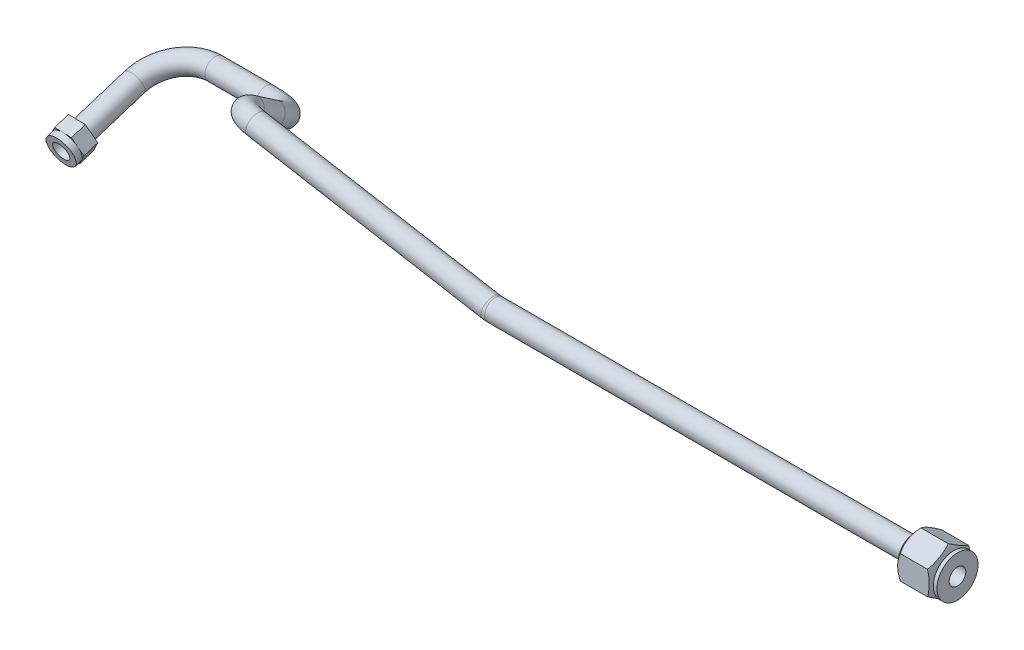
from build123d import *

# Parameters (mm, degrees)
SKETCH2_R             = 14.49115295
CUT_EXTRUDE1_DEPTH    = 51.306406252
SKETCH3_R             = 5
EXTRUDE1_DEPTH        = 10
SKETCH5_R             = 9.901602584
SKETCH5_R_2           = 7
CUT_EXTRUDE2_DEPTH    = 3
IZIM2_R               = 4
KES_EKSTR_ZYON1_DEPTH = 220
IZIM3_R               = 4
KES_EKSTR_ZYON2_DEPTH = 40


with BuildPart() as part:
    # Sketch1 → Revolve1 (revolve)
    with BuildSketch(Plane.XY, mode=Mode.PRIVATE) as revolve1_sk:
        with BuildLine():
            Line((180.080433705, 44.141017842), (173.530538009, 44.141017842))
            ThreePointArc((173.530538009, 44.141017842), (172.538729892, 41.151971535), (173.530538009, 38.162925228))
            Line((173.530538009, 38.162925228), (180.080433705, 38.162925228))
            Line((180.080433705, 38.162925228), (180.080433705, 44.141017842))
        make_face()
        with BuildLine():
            Line((186.630329401, 44.141017842), (180.080433705, 44.141017842))
            Line((180.080433705, 44.141017842), (180.080433705, 38.162925228))
            Line((180.080433705, 38.162925228), (186.630329401, 38.162925228))
            ThreePointArc((186.630329401, 38.162925228), (187.103282451, 38.934012994), (187.429565668, 39.777695512))
            ThreePointArc((187.429565668, 39.777695512), (187.540311425, 42.052840793), (186.630329401, 44.141017842))
        make_face()
        with BuildLine():
            Line((180.080433705, 38.162925228), (180.080433705, 32.650327481))
            Line((180.080433705, 32.650327481), (187.735613173, 32.650327481))
            ThreePointArc((187.735613173, 32.650327481), (187.427007794, 35.455556025), (186.630329401, 38.162925228))
            Line((186.630329401, 38.162925228), (180.080433705, 38.162925228))
        make_face()
        with BuildLine():
            ThreePointArc((173.530538009, 38.162925228), (172.733859616, 35.455556025), (172.425254237, 32.650327481))
            Line((172.425254237, 32.650327481), (180.080433705, 32.650327481))
            Line((180.080433705, 32.650327481), (180.080433705, 38.162925228))
            Line((180.080433705, 38.162925228), (173.530538009, 38.162925228))
        make_face()
        with BuildLine():
            Line((173.530538009, 44.141017842), (169.927279386, 39.777695512))
            Line((169.927279386, 39.777695512), (169.927279386, 32.650327481))
            Line((169.927279386, 32.650327481), (172.425254237, 32.650327481))
            ThreePointArc((172.425254237, 32.650327481), (172.733859616, 35.455556025), (173.530538009, 38.162925228))
            ThreePointArc((173.530538009, 38.162925228), (172.538729892, 41.151971535), (173.530538009, 44.141017842))
        make_face()
        with BuildLine():
            ThreePointArc((186.630329401, 38.162925228), (187.427007794, 35.455556025), (187.735613173, 32.650327481))
            Line((187.735613173, 32.650327481), (189.375361044, 32.650327481))
            Line((189.375361044, 32.650327481), (189.375361044, 39.777695512))
            Line((189.375361044, 39.777695512), (187.429565668, 39.777695512))
            ThreePointArc((187.429565668, 39.777695512), (187.103282451, 38.934012994), (186.630329401, 38.162925228))
        make_face()
        Polygon((189.375361044, 39.777695512), (189.375361044, 32.650327481), (191.146824361, 32.650327481), (191.146824361, 42.553378699), (189.375361044, 42.553378699), align=None)
    revolve(revolve1_sk.sketch.rotate(Axis((-32.579678715, 32.650327481, 0), (1, 0, 0)), 90), axis=Axis((-32.579678715, 32.650327481, 0), (1, 0, 0)))

    # Sketch2 → Cut-Extrude1 (cut, through all)
    with BuildSketch(Plane.ZY.offset(-169.927279386)):
        with Locations((0, 32.650327481)):
            Circle(SKETCH2_R)
        Polygon((0, 44.141017842), (-9.95122976, 38.395672661), (-9.95122976, 26.9049823), (0, 21.15963712), (9.95122976, 26.9049823), (9.95122976, 38.395672661), align=None, mode=Mode.SUBTRACT)
    extrude(amount=-CUT_EXTRUDE1_DEPTH, mode=Mode.SUBTRACT)

    # Sweep3: sweep along a curve in space
    with BuildLine() as sweep3_path:
        Line((-222.210887695, 24.006507797, -16.672116117), (-222.346014244, 12.594218126, 18.492799117))
        ThreePointArc((-202.211021283, 30.157684617, -35.625859644), (-216.32728873, 28.357408148, -30.07863194), (-222.210887695, 24.006507797, -16.672116117))
        Line((-177.748857503, 30.157684617, -35.625859644), (-202.211021283, 30.157684617, -35.625859644))
        ThreePointArc((-157.748857503, 41.483617341, -19.141829556), (-163.606721879, 33.474973508, -30.797799013), (-177.748857503, 30.157684617, -35.625859644))
        Line((-157.748857503, 48.387877179, -9.093206659), (-157.748857503, 41.483617341, -19.141829556))
        ThreePointArc((-146.882458064, 52.727054495, 0), (-154.498514664, 52.19594197, -2.719947791), (-157.748857503, 48.387877179, -9.093206659))
        Line((-33.438092351, 32.801103659, 0), (-146.882458064, 52.727054495, 0))
        ThreePointArc((-31.708124112, 32.650327481, 0), (-32.576387258, 32.688092836, 0), (-33.438092351, 32.801103659, 0))
        Line((-31.708124112, 32.650327481, 0), (169.927279386, 32.650327481, 0))
    # Sketch3 → Sweep3 (sweep)
    with BuildSketch(Plane.ZY.offset(-169.927279386)):
        with Locations((0, 32.650327481)):
            Circle(SKETCH3_R)
    sweep(path=sweep3_path.line)

    # Sketch4 → Extrude1 (add)
    with BuildSketch(Plane(origin=(-0.053050316, -4.480433927, 13.805650207), x_dir=(0.9999933205859823, -0.0011282410835596105, 0.0034764716996236633), z_dir=(-0.003654966952096285, -0.30868502023615024, 0.9511572948247765))):
        Polygon((-226.140355235, 24.796964016), (-230.374247953, 17.911654597), (-226.528341443, 10.802341238), (-218.448542214, 10.578337297), (-214.214649497, 17.463646715), (-218.060556007, 24.572960075), align=None)
    extrude(amount=-EXTRUDE1_DEPTH)

    # Sketch5 → Cut-Extrude2 (cut)
    with BuildSketch(Plane(origin=(-0.053050316, -4.480433927, 13.805650207), x_dir=(0.9999933205859823, -0.0011282410835596105, 0.0034764716996236633), z_dir=(-0.003654966952096285, -0.30868502023615024, 0.9511572948247765))):
        with Locations((-222.294448725, 17.687650656)):
            Circle(SKETCH5_R)
        with Locations(Location((-222.294448725, 17.687650656, 0), (0, 0, 270))):
            Circle(SKETCH5_R_2, mode=Mode.SUBTRACT)
    extrude(amount=-CUT_EXTRUDE2_DEPTH, mode=Mode.SUBTRACT)

    # Çizim2 → Kes-Ekstrüzyon1 (cut)
    with BuildSketch(Plane(origin=(191.146824361, 0, 0), x_dir=(0, 0, -1), z_dir=(1, 0, 0))):
        with Locations((0, 32.650327481)):
            Circle(IZIM2_R)
    extrude(amount=-KES_EKSTR_ZYON1_DEPTH, mode=Mode.SUBTRACT)

    # Çizim3 → Kes-Ekstrüzyon2 (cut)
    with BuildSketch(Plane(origin=(-0.053050316, -4.480433927, 13.805650207), x_dir=(0.9999933205859823, -0.0011282410835595914, 0.003476471699623597), z_dir=(-0.003654966952096216, -0.3086850202361507, 0.9511572948247764))):
        with Locations(Location((-222.294448725, 17.687650656, 0), (0, 0, 270))):
            Circle(IZIM3_R)
    extrude(amount=-KES_EKSTR_ZYON2_DEPTH, mode=Mode.SUBTRACT)


solid = part.part
